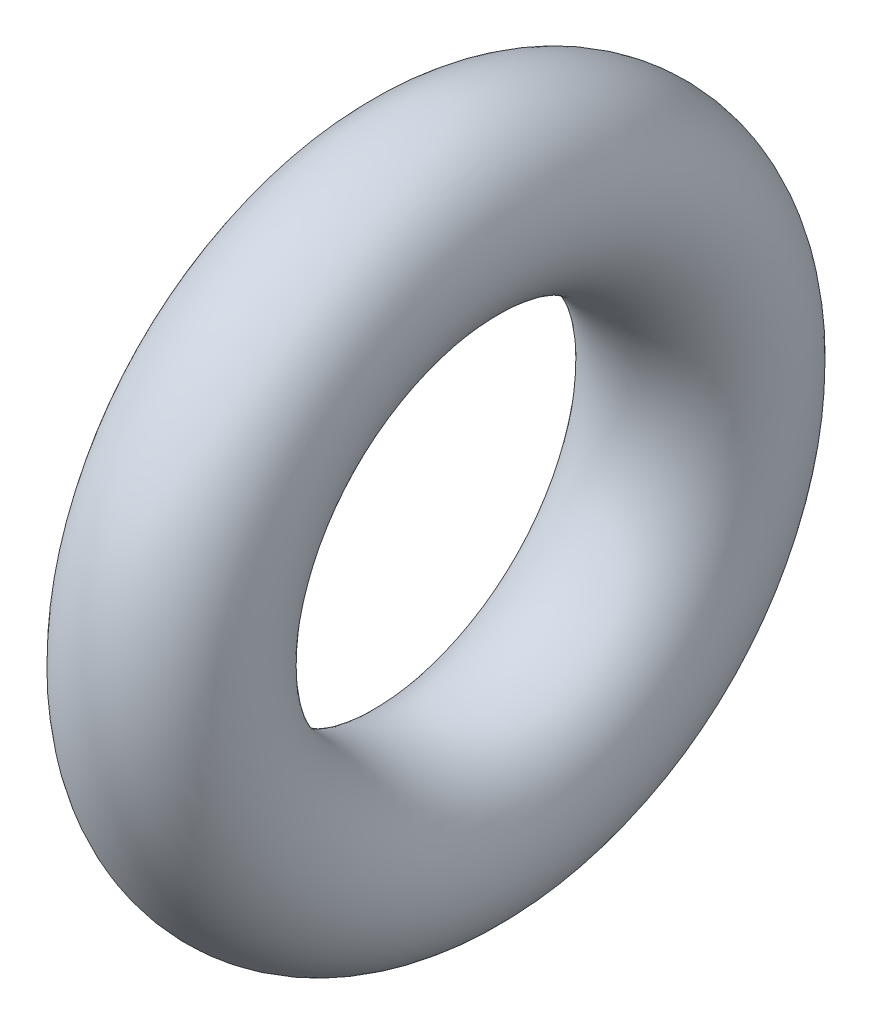
from build123d import *

# Parameters (mm, degrees)
ESQUISSE1_R = 2.5


with BuildPart() as part:
    # Esquisse1 → Révolution1 (revolve)
    with BuildSketch(Plane.XY, mode=Mode.PRIVATE) as r_volution1_sk:
        with Locations((15.631924887, 7.5)):
            Circle(ESQUISSE1_R)
    revolve(r_volution1_sk.sketch.rotate(Axis((8.333174163, 0, 0), (1, 0, 0)), 90), axis=Axis((8.333174163, 0, 0), (1, 0, 0)))


solid = part.part
